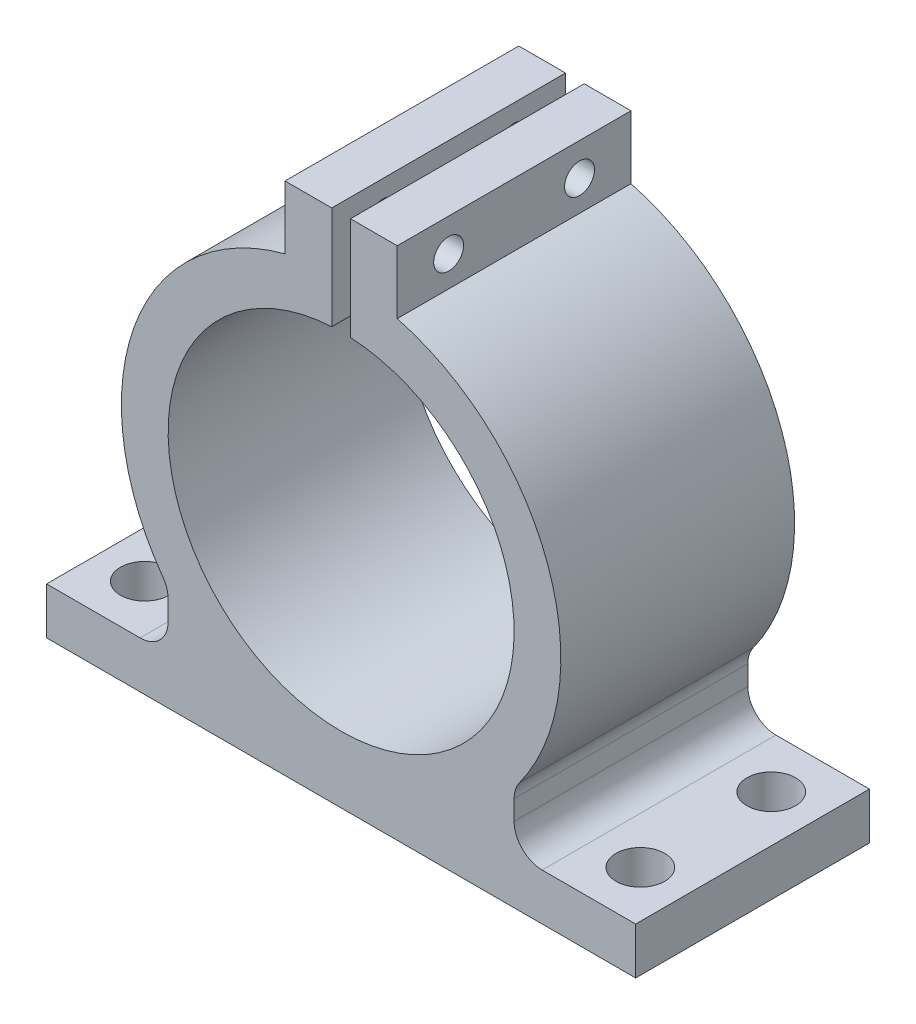
from build123d import *

# Parameters (mm, degrees)
BOSS_EXTRUDE1_DEPTH = 25
SKETCH2_W           = 25
SKETCH2_H           = 5
BOSS_EXTRUDE2_DEPTH = 13
FILLET1_R           = 3
SKETCH3_R           = 2.6
CUT_EXTRUDE1_DEPTH  = 65.222664554
FILLET2_R           = 3
SKETCH4_R           = 1.6
CUT_EXTRUDE2_DEPTH  = 54.850765737


with BuildPart() as part:
    # Sketch1 → Boss-Extrude1 (new body)
    with BuildSketch(Plane.XY):
        with BuildLine():
            Line((-18.5, -25.6), (18.5, -25.6))
            Line((18.5, -25.6), (18.5, -14.491376746))
            ThreePointArc((18.5, -14.491376746), (22.27678764, 7.482962811), (6, 22.721135535))
            Line((6, 22.721135535), (6, 29.472953202))
            Line((6, 29.472953202), (1, 29.472953202))
            Line((1, 29.472953202), (1, 18.472953202))
            ThreePointArc((1, 18.472953202), (0, -18.5), (-1, 18.472953202))
            Line((-1, 18.472953202), (-1, 29.472953202))
            Line((-1, 29.472953202), (-6, 29.472953202))
            Line((-6, 29.472953202), (-6, 22.721135535))
            ThreePointArc((-6, 22.721135535), (-22.27678764, 7.482962811), (-18.5, -14.491376746))
            Line((-18.5, -14.491376746), (-18.5, -25.6))
        make_face()
    extrude(amount=BOSS_EXTRUDE1_DEPTH)

    # Sketch2 → Boss-Extrude2 (add)
    with BuildSketch(Plane.ZY.offset(18.5)):
        with Locations((12.5, -23.1)):
            Rectangle(SKETCH2_W, SKETCH2_H)
    boss_extrude2 = extrude(amount=BOSS_EXTRUDE2_DEPTH)

    # Fillet1
    fillet1_edges = [part.edges().sort_by_distance(p)[0] for p in [
        (-18.5, -14.491376746, 12.5),
        (-18.5, -20.6, 12.5),
    ]]
    fillet(fillet1_edges, radius=FILLET1_R)

    # Sketch3 → Cut-Extrude1 (cut, through all)
    with BuildSketch(Plane(origin=(0, -20.6, 0), x_dir=(1, 0, 0), z_dir=(0, 1, 0))):
        with Locations(Location((-26.5, -19.5, 0), (0, 0, 270))):
            Circle(SKETCH3_R)
        with Locations(Location((-26.5, -5.5, 0), (0, 0, 270))):
            Circle(SKETCH3_R)
    cut_extrude1 = extrude(amount=-CUT_EXTRUDE1_DEPTH, mode=Mode.SUBTRACT)

    # Mirror3: Boss-Extrude2, Cut-Extrude1 across plane
    add(boss_extrude2.mirror(Plane(origin=(0, 0, 0), x_dir=(0, 0, 1), z_dir=(1, 0, 0))))
    add(cut_extrude1.mirror(Plane(origin=(0, 0, 0), x_dir=(0, 0, 1), z_dir=(1, 0, 0))), mode=Mode.SUBTRACT)

    # Fillet2
    fillet2_edges = [part.edges().sort_by_distance(p)[0] for p in [
        (18.5, -14.491376746, 12.5),
        (18.5, -20.6, 12.5),
    ]]
    fillet(fillet2_edges, radius=FILLET2_R)

    # Sketch4 → Cut-Extrude2 (cut, through all)
    with BuildSketch(Plane.ZY.offset(6)):
        with Locations(Location((19.5, 25.972953202, 0), (0, 0, 270))):
            Circle(SKETCH4_R)
        with Locations(Location((5.5, 25.972953202, 0), (0, 0, 270))):
            Circle(SKETCH4_R)
    extrude(amount=-CUT_EXTRUDE2_DEPTH, mode=Mode.SUBTRACT)


solid = part.part
